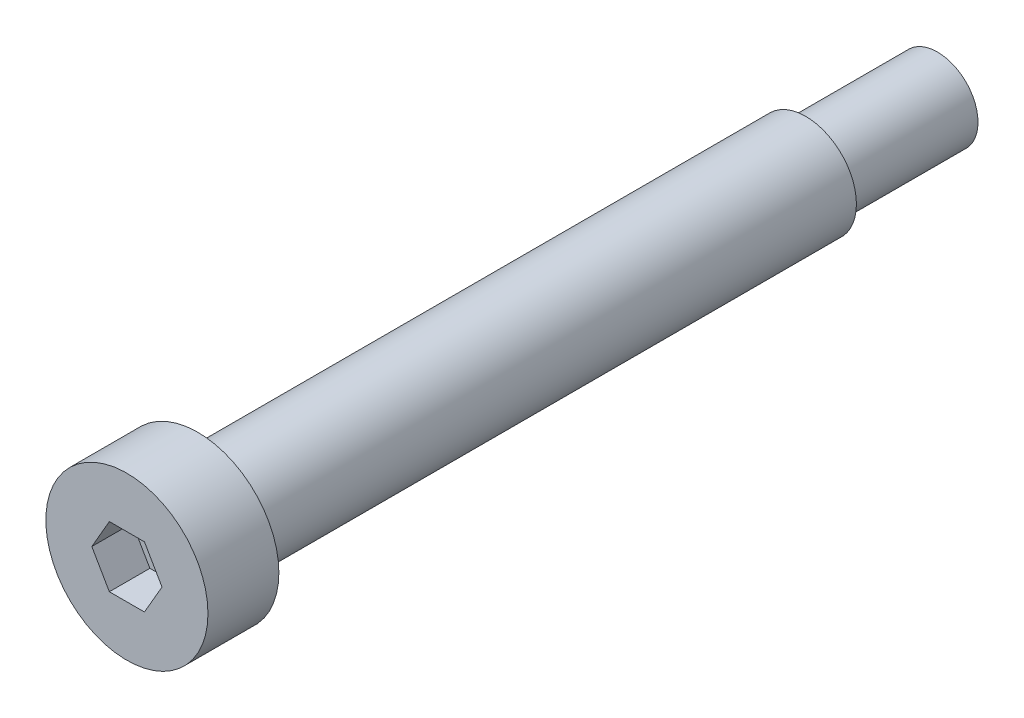
from build123d import *

# Parameters (mm, degrees)
SKETCH1_R      = 2
THREAD_DEPTH   = 6.5
SKETCH2_R      = 2.5
SHOULDER_DEPTH = 30
SKETCH3_R      = 4
HEAD_DEPTH     = 3.5
SOCKET_DEPTH   = 2


with BuildPart() as part:
    # Sketch1 → Thread (new body)
    with BuildSketch(Plane.XY):
        Circle(SKETCH1_R)
    extrude(amount=THREAD_DEPTH)

    # Sketch2 → Shoulder (add)
    with BuildSketch(Plane.XY.offset(6.5)):
        Circle(SKETCH2_R)
    extrude(amount=SHOULDER_DEPTH)

    # Sketch3 → Head (add)
    with BuildSketch(Plane.XY.offset(36.5)):
        Circle(SKETCH3_R)
    extrude(amount=HEAD_DEPTH)

    # Sketch4 → Socket (cut)
    with BuildSketch(Plane.XY.offset(38)):
        Polygon((1.732050808, 0), (0.866025404, 1.5), (-0.866025404, 1.5), (-1.732050808, 0), (-0.866025404, -1.5), (0.866025404, -1.5), align=None)
    extrude(amount=SOCKET_DEPTH, mode=Mode.SUBTRACT)


solid = part.part
